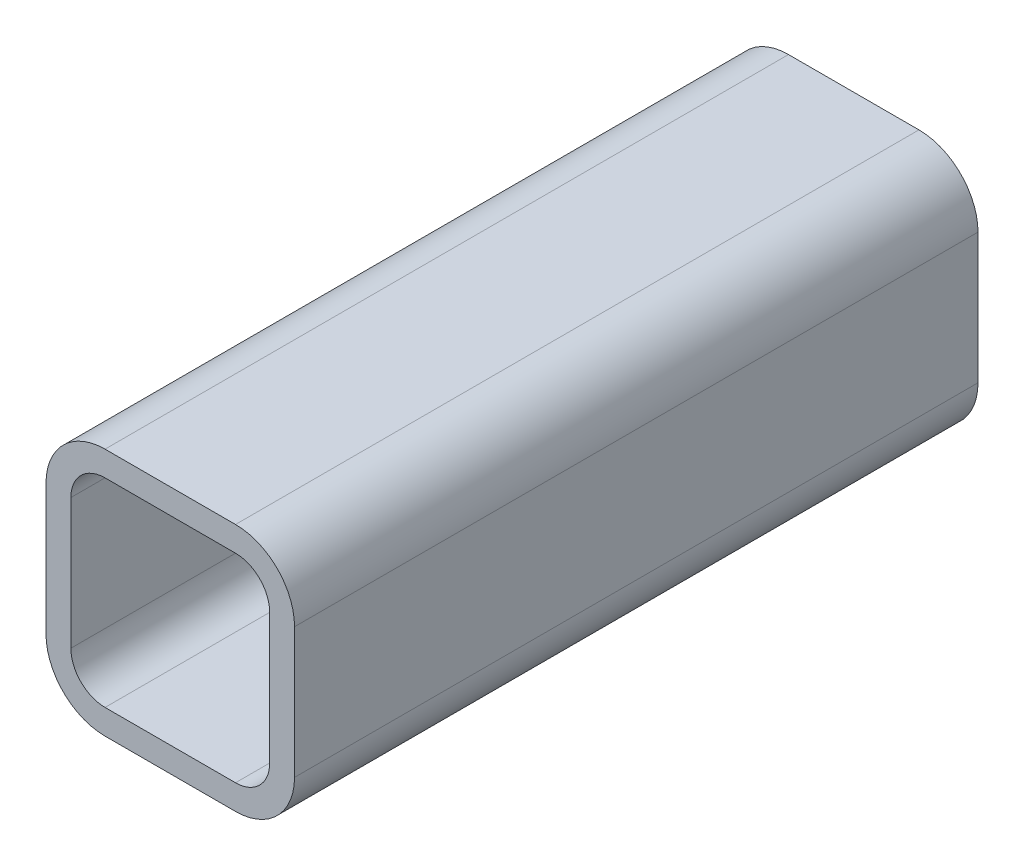
from build123d import *

# Parameters (mm, degrees)
EXTRUDE_1_DEPTH = 110
M10X1_0_1_D     = 9
M10X1_0_1_DEPTH = 23
M10X1_0_1_TIP   = 2.703872786


with BuildPart() as part:
    # 草图1 → 凸台-拉伸1 (new, symmetric)
    with BuildSketch(Plane.XY):
        with BuildLine():
            Line((-21, 40), (21, 40))
            ThreePointArc((21, 40), (34.435028843, 34.435028843), (40, 21))
            Line((40, 21), (40, -21))
            ThreePointArc((40, -21), (34.435028843, -34.435028843), (21, -40))
            Line((21, -40), (-21, -40))
            ThreePointArc((-21, -40), (-34.435028843, -34.435028843), (-40, -21))
            Line((-40, -21), (-40, 21))
            ThreePointArc((-40, 21), (-34.435028843, 34.435028843), (-21, 40))
        make_face()
        with BuildLine():
            Line((-32, 21), (-32, -21))
            ThreePointArc((-32, -21), (-28.778174593, -28.778174593), (-21, -32))
            Line((-21, -32), (21, -32))
            ThreePointArc((21, -32), (28.778174593, -28.778174593), (32, -21))
            Line((32, -21), (32, 21))
            ThreePointArc((32, 21), (28.778174593, 28.778174593), (21, 32))
            Line((21, 32), (-21, 32))
            ThreePointArc((-21, 32), (-28.778174593, 28.778174593), (-32, 21))
        make_face(mode=Mode.SUBTRACT)
    extrude(amount=EXTRUDE_1_DEPTH, both=True)

    # M10x1.0 螺纹孔1
    with Locations(Plane(origin=(0, -40, 0), x_dir=(-1, 0, 0), z_dir=(0, -1, 0))):
        with Locations((0, 0)):
            Hole(M10X1_0_1_D / 2, depth=M10X1_0_1_DEPTH)
            with Locations((0, 0, -(M10X1_0_1_DEPTH + M10X1_0_1_TIP / 2))):  # 118° drill point
                Cone(0, M10X1_0_1_D / 2, M10X1_0_1_TIP, mode=Mode.SUBTRACT)


solid = part.part
